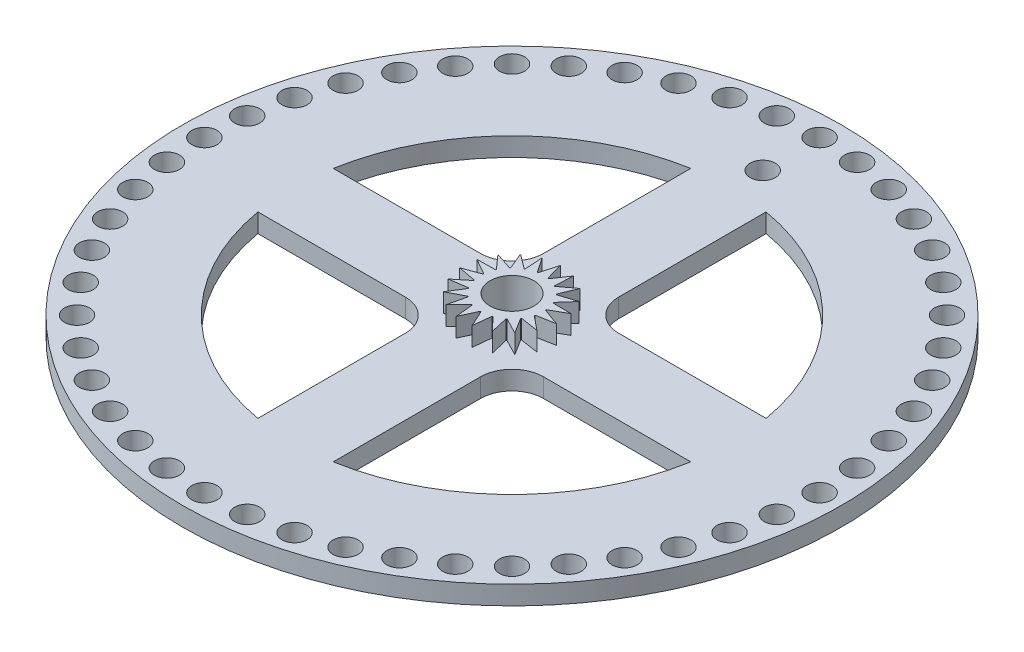
from build123d import *

# Parameters (mm, degrees)
SKETCH1_R               = 26.25
BOSS_EXTRUDE1_DEPTH     = 1.5
SKETCH2_R               = 17.5
CUT_EXTRUDE1_DEPTH      = 4.5
SKETCH3_R               = 1
CUT_EXTRUDE2_DEPTH      = 2.5
SKETCH5_R               = 1
CUT_EXTRUDE3_DEPTH      = 1.5
BOSS_EXTRUDE4_DEPTH     = 1.5
CUT_EXTRUDE4_DEPTH      = 10
CUT_EXTRUDE4_DEPTH_BACK = 1.5
SKETCH7_R               = 1.75
SKETCH12_R              = 2.5
BOSS_EXTRUDE6_DEPTH     = 1.5
CUT_EXTRUDE5_START      = 1.5
SKETCH13_R              = 1.75
CUT_EXTRUDE5_DEPTH      = 1.5
BOSS_EXTRUDE8_DEPTH     = 1.5


with BuildPart() as part:
    # Sketch1 → Boss-Extrude1 (new body)
    with BuildSketch(Plane(origin=(0, 0, 0), x_dir=(1, 0, 0), z_dir=(0, 1, 0))):
        with Locations(Location((0, 0, 0), (0, 0, 270))):
            Circle(SKETCH1_R)
    extrude(amount=BOSS_EXTRUDE1_DEPTH)

    # Sketch2 → Cut-Extrude1 (cut)
    with BuildSketch(Plane(origin=(0, 1.5, 0), x_dir=(1, 0, 0), z_dir=(0, 1, 0))):
        with Locations(Location((0, 0, 0), (0, 0, 270))):
            Circle(SKETCH2_R)
    extrude(amount=-CUT_EXTRUDE1_DEPTH, mode=Mode.SUBTRACT)

    # Sketch3 → Cut-Extrude2 (cut)
    with BuildSketch(Plane(origin=(0, 1.5, 0), x_dir=(1, 0, 0), z_dir=(0, 1, 0))):
        with Locations(Location((0, 24.5, 0), (0, 0, 270))):
            Circle(SKETCH3_R)
        with Locations(Location((3.197891709, 24.290399104, 0), (0, 0, 270))):
            Circle(SKETCH3_R)
        with Locations(Location((6.341066605, 23.665182744, 0), (0, 0, 270))):
            Circle(SKETCH3_R)
        with Locations(Location((9.375744093, 22.635048547, 0), (0, 0, 270))):
            Circle(SKETCH3_R)
        with Locations(Location((12.25, 21.217622393, 0), (0, 0, 270))):
            Circle(SKETCH3_R)
        with Locations(Location((14.914655011, 19.437156837, 0), (0, 0, 270))):
            Circle(SKETCH3_R)
        with Locations(Location((17.324116139, 17.324116139, 0), (0, 0, 270))):
            Circle(SKETCH3_R)
        with Locations(Location((19.437156837, 14.914655011, 0), (0, 0, 270))):
            Circle(SKETCH3_R)
        with Locations(Location((21.217622393, 12.25, 0), (0, 0, 270))):
            Circle(SKETCH3_R)
        with Locations(Location((22.635048547, 9.375744093, 0), (0, 0, 270))):
            Circle(SKETCH3_R)
        with Locations(Location((23.665182744, 6.341066605, 0), (0, 0, 270))):
            Circle(SKETCH3_R)
        with Locations(Location((24.290399104, 3.197891709, 0), (0, 0, 270))):
            Circle(SKETCH3_R)
        with Locations(Location((24.5, 0, 0), (0, 0, 270))):
            Circle(SKETCH3_R)
        with Locations(Location((24.290399104, -3.197891709, 0), (0, 0, 270))):
            Circle(SKETCH3_R)
        with Locations(Location((23.665182744, -6.341066605, 0), (0, 0, 270))):
            Circle(SKETCH3_R)
        with Locations(Location((22.635048547, -9.375744093, 0), (0, 0, 270))):
            Circle(SKETCH3_R)
        with Locations(Location((21.217622393, -12.25, 0), (0, 0, 270))):
            Circle(SKETCH3_R)
        with Locations(Location((19.437156837, -14.914655011, 0), (0, 0, 270))):
            Circle(SKETCH3_R)
        with Locations(Location((17.324116139, -17.324116139, 0), (0, 0, 270))):
            Circle(SKETCH3_R)
        with Locations(Location((14.914655011, -19.437156837, 0), (0, 0, 270))):
            Circle(SKETCH3_R)
        with Locations(Location((12.25, -21.217622393, 0), (0, 0, 270))):
            Circle(SKETCH3_R)
        with Locations(Location((9.375744093, -22.635048547, 0), (0, 0, 270))):
            Circle(SKETCH3_R)
        with Locations(Location((6.341066605, -23.665182744, 0), (0, 0, 270))):
            Circle(SKETCH3_R)
        with Locations(Location((3.197891709, -24.290399104, 0), (0, 0, 270))):
            Circle(SKETCH3_R)
        with Locations(Location((0, -24.5, 0), (0, 0, 270))):
            Circle(SKETCH3_R)
        with Locations(Location((-3.197891709, -24.290399104, 0), (0, 0, 270))):
            Circle(SKETCH3_R)
        with Locations(Location((-6.341066605, -23.665182744, 0), (0, 0, 270))):
            Circle(SKETCH3_R)
        with Locations(Location((-9.375744093, -22.635048547, 0), (0, 0, 270))):
            Circle(SKETCH3_R)
        with Locations(Location((-12.25, -21.217622393, 0), (0, 0, 270))):
            Circle(SKETCH3_R)
        with Locations(Location((-14.914655011, -19.437156837, 0), (0, 0, 270))):
            Circle(SKETCH3_R)
        with Locations(Location((-17.324116139, -17.324116139, 0), (0, 0, 270))):
            Circle(SKETCH3_R)
        with Locations(Location((-19.437156837, -14.914655011, 0), (0, 0, 270))):
            Circle(SKETCH3_R)
        with Locations(Location((-21.217622393, -12.25, 0), (0, 0, 270))):
            Circle(SKETCH3_R)
        with Locations(Location((-22.635048547, -9.375744093, 0), (0, 0, 270))):
            Circle(SKETCH3_R)
        with Locations(Location((-23.665182744, -6.341066605, 0), (0, 0, 270))):
            Circle(SKETCH3_R)
        with Locations(Location((-24.290399104, -3.197891709, 0), (0, 0, 270))):
            Circle(SKETCH3_R)
        with Locations(Location((-24.5, 0, 0), (0, 0, 270))):
            Circle(SKETCH3_R)
        with Locations(Location((-24.290399104, 3.197891709, 0), (0, 0, 270))):
            Circle(SKETCH3_R)
        with Locations(Location((-23.665182744, 6.341066605, 0), (0, 0, 270))):
            Circle(SKETCH3_R)
        with Locations(Location((-22.635048547, 9.375744093, 0), (0, 0, 270))):
            Circle(SKETCH3_R)
        with Locations(Location((-21.217622393, 12.25, 0), (0, 0, 270))):
            Circle(SKETCH3_R)
        with Locations(Location((-19.437156837, 14.914655011, 0), (0, 0, 270))):
            Circle(SKETCH3_R)
        with Locations(Location((-17.324116139, 17.324116139, 0), (0, 0, 270))):
            Circle(SKETCH3_R)
        with Locations(Location((-14.914655011, 19.437156837, 0), (0, 0, 270))):
            Circle(SKETCH3_R)
        with Locations(Location((-12.25, 21.217622393, 0), (0, 0, 270))):
            Circle(SKETCH3_R)
        with Locations(Location((-9.375744093, 22.635048547, 0), (0, 0, 270))):
            Circle(SKETCH3_R)
        with Locations(Location((-6.341066605, 23.665182744, 0), (0, 0, 270))):
            Circle(SKETCH3_R)
        with Locations(Location((-3.197891709, 24.290399104, 0), (0, 0, 270))):
            Circle(SKETCH3_R)
    extrude(amount=-CUT_EXTRUDE2_DEPTH, mode=Mode.SUBTRACT)

    # Sketch5 → Cut-Extrude3 (cut)
    with BuildSketch(Plane(origin=(0, 1.5, 0), x_dir=(1, 0, 0), z_dir=(0, 1, 0))):
        with Locations(Location((0, 19.972095444, 0), (0, 0, 270))):
            Circle(SKETCH5_R)
    extrude(amount=-CUT_EXTRUDE3_DEPTH, mode=Mode.SUBTRACT)

    # Sketch6 → Boss-Extrude4 (add)
    with BuildSketch(Plane(origin=(0, 1.5, 0), x_dir=(1, 0, 0), z_dir=(0, 1, 0))):
        with BuildLine():
            Line((-3, 5.5), (-3, 17.24093965))
            Line((-3, 17.24093965), (0, 18.195849362))
            Line((0, 18.195849362), (3, 17.24093965))
            Line((3, 17.24093965), (3, 5.5))
            ThreePointArc((3, 5.5), (3.732233047, 3.732233047), (5.5, 3))
            Line((5.5, 3), (17.24093965, 3))
            Line((17.24093965, 3), (18.195849362, 0))
            Line((18.195849362, 0), (17.24093965, -3))
            Line((17.24093965, -3), (5.5, -3))
            ThreePointArc((5.5, -3), (3.732233047, -3.732233047), (3, -5.5))
            Line((3, -5.5), (3, -17.24093965))
            Line((3, -17.24093965), (0, -18.195849362))
            Line((0, -18.195849362), (-3, -17.24093965))
            Line((-3, -17.24093965), (-3, -5.5))
            ThreePointArc((-3, -5.5), (-3.732233047, -3.732233047), (-5.5, -3))
            Line((-5.5, -3), (-17.24093965, -3))
            Line((-17.24093965, -3), (-18.195849362, 0))
            Line((-18.195849362, 0), (-17.24093965, 3))
            Line((-17.24093965, 3), (-5.5, 3))
            ThreePointArc((-5.5, 3), (-3.732233047, 3.732233047), (-3, 5.5))
        make_face()
    extrude(amount=-BOSS_EXTRUDE4_DEPTH)

    # Sketch7 → Cut-Extrude4 (cut, two sides: drawn at the far end of the back side and taken through both)
    with BuildSketch(Plane(origin=(0, 1.5, 0), x_dir=(1, 0, 0), z_dir=(0, 1, 0)).offset(-CUT_EXTRUDE4_DEPTH_BACK)):
        with Locations(Location((0, 0, 0), (0, 0, 270))):
            Circle(SKETCH7_R)
    extrude(amount=CUT_EXTRUDE4_DEPTH + CUT_EXTRUDE4_DEPTH_BACK, mode=Mode.SUBTRACT)

    # Sketch12 → Boss-Extrude6 (add)
    with BuildSketch(Plane(origin=(0, 1.5, 0), x_dir=(1, 0, 0), z_dir=(0, 1, 0))):
        with Locations(Location((0, 0, 0), (0, 0, 270))):
            Circle(SKETCH12_R)
    extrude(amount=BOSS_EXTRUDE6_DEPTH)

    # Sketch13 → Cut-Extrude5 (cut)
    with BuildSketch(Plane(origin=(0, 1.5, 0), x_dir=(1, 0, 0), z_dir=(0, 1, 0)).offset(CUT_EXTRUDE5_START)):
        with Locations(Location((0, 0, 0), (0, 0, 270))):
            Circle(SKETCH13_R)
    extrude(amount=-CUT_EXTRUDE5_DEPTH, mode=Mode.SUBTRACT)

    # Sketch15 → Boss-Extrude8 (add)
    with BuildSketch(Plane(origin=(0, 1.5, 0), x_dir=(1, 0, 0), z_dir=(0, 1, 0))):
        Polygon((0, 2.35221672), (0, 2.5), (0, 3.865552121), (-0.3804441, 2.470882896), align=None)
        Polygon((0, 3.865552121), (0, 2.5), (0, 2.35221672), (0.3804441, 2.470882896), align=None)
        Polygon((0.763763521, 2.22476713), (0.442463776, 2.460533643), (1.255142722, 3.656105844), (1.162124954, 2.213473648), align=None)
        Polygon((1.444761413, 1.856229501), (1.217423836, 2.18354739), (2.374271254, 3.05046377), (1.817871537, 1.716200185), align=None)
        Polygon((1.969196988, 1.286540603), (1.860457133, 1.669939896), (3.236110655, 2.114256612), (2.276623532, 1.032949802), align=None)
        Polygon((2.280239514, 0.577435067), (2.301881031, 0.975368503), (3.747267254, 0.948936945), (2.488668042, 0.23776328), align=None)
        Polygon((2.344182708, -0.194244517), (2.493860403, 0.175100798), (3.8523493, -0.319214764), (2.431026754, -0.583188583), align=None)
        Polygon((-1.444761413, 1.856229501), (-1.817871537, 1.716200185), (-2.374271254, 3.05046377), (-1.217423836, 2.18354739), align=None)
        Polygon((-1.969196988, 1.286540603), (-2.276623532, 1.032949802), (-3.236110655, 2.114256612), (-1.860457133, 1.669939896), align=None)
        Polygon((-2.280239514, 0.577435067), (-2.488668042, 0.23776328), (-3.747267254, 0.948936945), (-2.301881031, 0.975368503), align=None)
        Polygon((-2.344182708, -0.194244517), (-2.431026754, -0.583188583), (-3.8523493, -0.319214764), (-2.493860403, 0.175100798), align=None)
        Polygon((-2.154097331, -0.944874694), (-2.109945995, -1.340942913), (-3.539969525, -1.552774601), (-2.415591304, -0.644141795), align=None)
        Polygon((-1.730582084, -1.593113037), (-1.560219849, -1.953385272), (-2.843979123, -2.618067215), (-2.075555405, -1.39358163), align=None)
        Polygon((-1.119531416, -2.068712863), (-0.841419673, -2.354148027), (-1.839799454, -3.399651624), (-1.510600873, -1.992005272), align=None)
        Polygon((-0.387162147, -2.32013555), (-0.03143862, -2.499802315), (-0.636248967, -3.812831028), (-0.781949296, -2.374564233), align=None)
        Polygon((1.119531416, -2.068712863), (1.510600873, -1.992005272), (1.839799454, -3.399651624), (0.841419673, -2.354148027), align=None)
        Polygon((1.730582084, -1.593113037), (2.075555405, -1.39358163), (2.843979123, -2.618067215), (1.560219849, -1.953385272), align=None)
        Polygon((2.154097331, -0.944874694), (2.415591304, -0.644141795), (3.539969525, -1.552774601), (2.109945995, -1.340942913), align=None)
        Polygon((-1.162124954, 2.213473648), (-1.255142722, 3.656105844), (-0.442463776, 2.460533643), (-0.763763521, 2.22476713), align=None)
        Polygon((0.781949296, -2.374564233), (0.636248967, -3.812831028), (0.03143862, -2.499802315), (0.387162147, -2.32013555), align=None)
    extrude(amount=BOSS_EXTRUDE8_DEPTH)


solid = part.part
